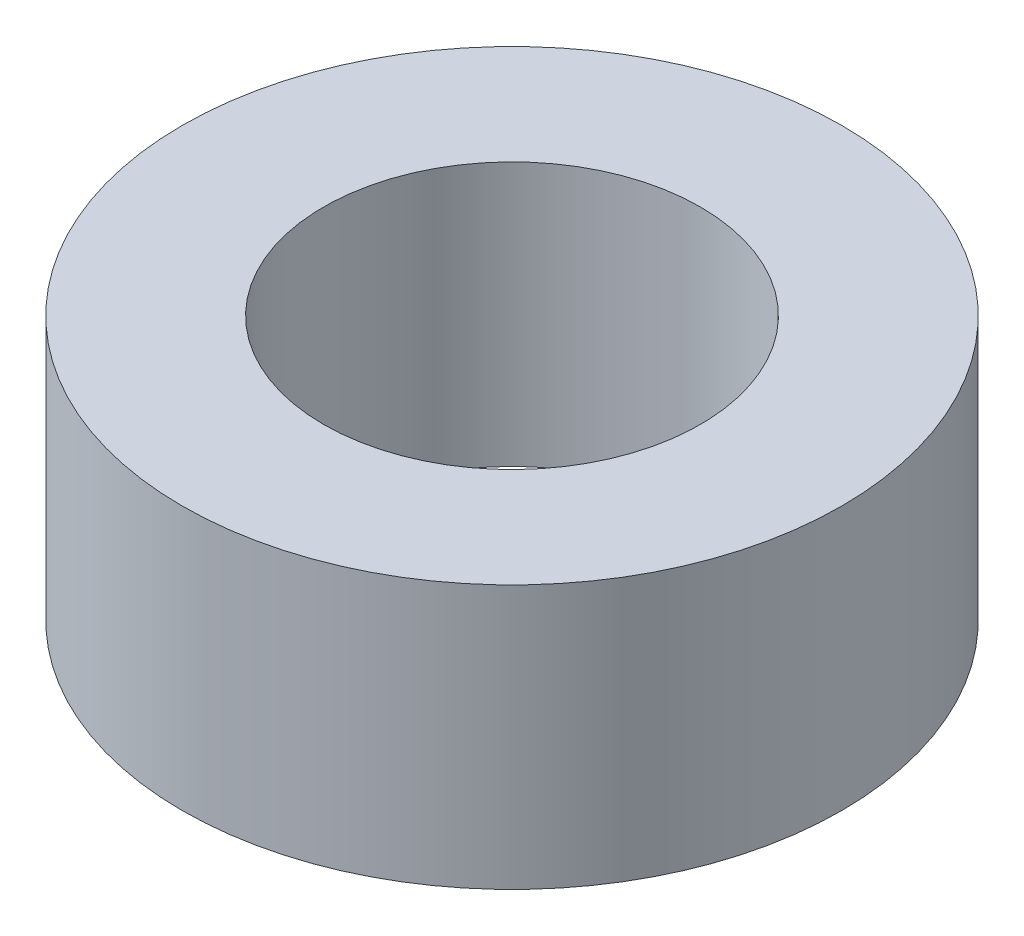
from build123d import *

# Parameters (mm, degrees)
SKETCH1_R           = 3.5
SKETCH1_R_2         = 2
BOSS_EXTRUDE1_DEPTH = 2.8


with BuildPart() as part:
    # Sketch1 → Boss-Extrude1 (new body)
    with BuildSketch(Plane(origin=(0, 0, 0), x_dir=(1, 0, 0), z_dir=(0, 1, 0))):
        with Locations(Location((0, 0, 0), (0, 0, 270))):
            Circle(SKETCH1_R)
        with Locations(Location((0, 0, 0), (0, 0, 270))):
            Circle(SKETCH1_R_2, mode=Mode.SUBTRACT)
    extrude(amount=BOSS_EXTRUDE1_DEPTH)


solid = part.part
